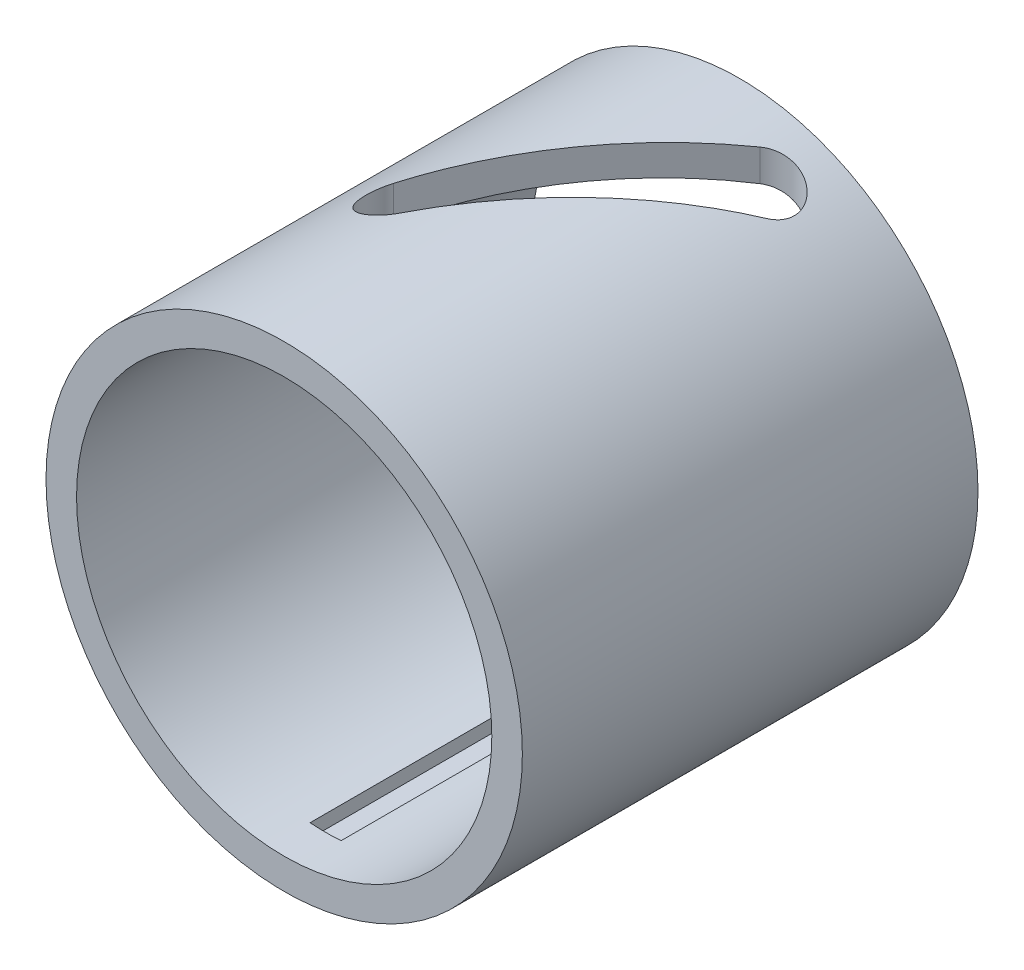
from build123d import *

# Parameters (mm, degrees)
SKETCH_1_R          = 23
SKETCH_1_R_2        = 20.05
EXTRUDE_1_DEPTH     = 44
CUT_EXTRUDE_1_DEPTH = 40
SKETCH_3_W          = 3
SKETCH_3_H          = 2.5
CUT_EXTRUDE_2_DEPTH = 40


with BuildPart() as part:
    # 스케치1 → 보스-돌출1 (new body)
    with BuildSketch(Plane.XY):
        Circle(SKETCH_1_R)
        Circle(SKETCH_1_R_2, mode=Mode.SUBTRACT)
    extrude(amount=EXTRUDE_1_DEPTH)

    # 스케치2 → 컷-돌출1 (cut)
    with BuildSketch(Plane(origin=(0, 0, 0), x_dir=(1, 0, 0), z_dir=(0, 1, 0))):
        with BuildLine():
            Line((-10.470977563, -22.970475817), (5.930302333, -3.982092632))
            ThreePointArc((5.930302333, -3.982092632), (10.161651705, -3.672766774), (10.470977563, -7.904116147))
            Line((10.470977563, -7.904116147), (-5.930302333, -26.892499333))
            ThreePointArc((-5.930302333, -26.892499333), (-10.161651705, -27.20182519), (-10.470977563, -22.970475817))
        make_face()
    extrude(amount=CUT_EXTRUDE_1_DEPTH, mode=Mode.SUBTRACT)

    # 스케치3 → 컷-돌출2 (cut)
    with BuildSketch(Plane.XY):
        with Locations((0, -20.05)):
            Rectangle(SKETCH_3_W, SKETCH_3_H)
    extrude(amount=CUT_EXTRUDE_2_DEPTH, mode=Mode.SUBTRACT)


solid = part.part
